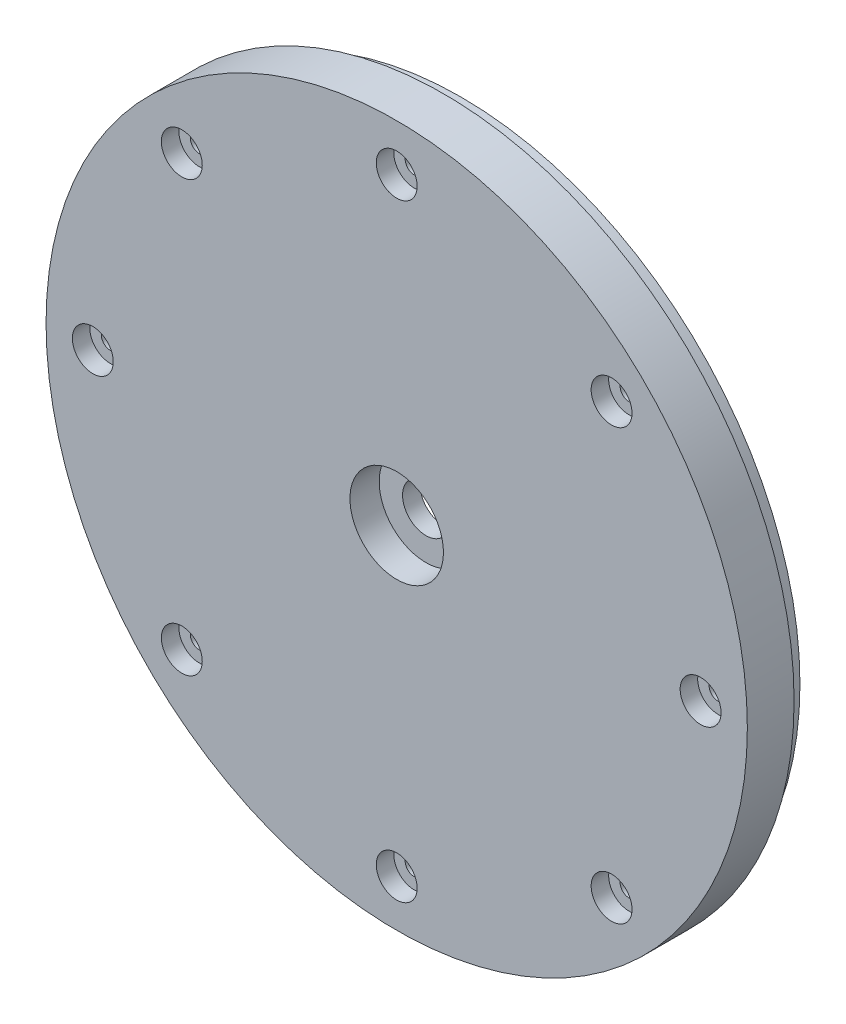
from build123d import *

# Parameters (mm, degrees)
SKETCH1_R           = 60
SKETCH1_R_2         = 4
SKETCH1_R_3         = 1.55
BOSS_EXTRUDE2_DEPTH = 8
SKETCH2_R           = 8
CUT_EXTRUDE1_DEPTH  = 5
SKETCH3_R           = 3.5
CUT_EXTRUDE2_DEPTH  = 3
SKETCH4_R           = 58
SKETCH4_R_2         = 56
BOSS_EXTRUDE3_DEPTH = 3


with BuildPart() as part:
    # Sketch1 → Boss-Extrude2 (new body)
    with BuildSketch(Plane.XY):
        Circle(SKETCH1_R)
        Circle(SKETCH1_R_2, mode=Mode.SUBTRACT)
        with Locations((-36.769552622, 36.769552622)):
            Circle(SKETCH1_R_3, mode=Mode.SUBTRACT)
        with Locations((0, 52)):
            Circle(SKETCH1_R_3, mode=Mode.SUBTRACT)
        with Locations((36.769552622, 36.769552622)):
            Circle(SKETCH1_R_3, mode=Mode.SUBTRACT)
        with Locations((52, 0)):
            Circle(SKETCH1_R_3, mode=Mode.SUBTRACT)
        with Locations((36.769552622, -36.769552622)):
            Circle(SKETCH1_R_3, mode=Mode.SUBTRACT)
        with Locations((0, -52)):
            Circle(SKETCH1_R_3, mode=Mode.SUBTRACT)
        with Locations((-36.769552622, -36.769552622)):
            Circle(SKETCH1_R_3, mode=Mode.SUBTRACT)
        with Locations((-52, 0)):
            Circle(SKETCH1_R_3, mode=Mode.SUBTRACT)
    extrude(amount=BOSS_EXTRUDE2_DEPTH)

    # Sketch2 → Cut-Extrude1 (cut)
    with BuildSketch(Plane.XY.offset(8)):
        Circle(SKETCH2_R)
    extrude(amount=-CUT_EXTRUDE1_DEPTH, mode=Mode.SUBTRACT)

    # Sketch3 → Cut-Extrude2 (cut)
    with BuildSketch(Plane.XY.offset(8)):
        with Locations((0, 52)):
            Circle(SKETCH3_R)
        with Locations((36.769552622, 36.769552622)):
            Circle(SKETCH3_R)
        with Locations((52, 0)):
            Circle(SKETCH3_R)
        with Locations((36.769552622, -36.769552622)):
            Circle(SKETCH3_R)
        with Locations((0, -52)):
            Circle(SKETCH3_R)
        with Locations((-36.769552622, -36.769552622)):
            Circle(SKETCH3_R)
        with Locations((-52, 0)):
            Circle(SKETCH3_R)
        with Locations((-36.769552622, 36.769552622)):
            Circle(SKETCH3_R)
    extrude(amount=-CUT_EXTRUDE2_DEPTH, mode=Mode.SUBTRACT)

    # Sketch4 → Boss-Extrude3 (add)
    with BuildSketch(Plane(origin=(0, 0, 0), x_dir=(-1, 0, 0), z_dir=(0, 0, -1))):
        with Locations(Location((0, 0, 0), (0, 0, 180))):
            Circle(SKETCH4_R)
        Circle(SKETCH4_R_2, mode=Mode.SUBTRACT)
    extrude(amount=BOSS_EXTRUDE3_DEPTH)


solid = part.part
